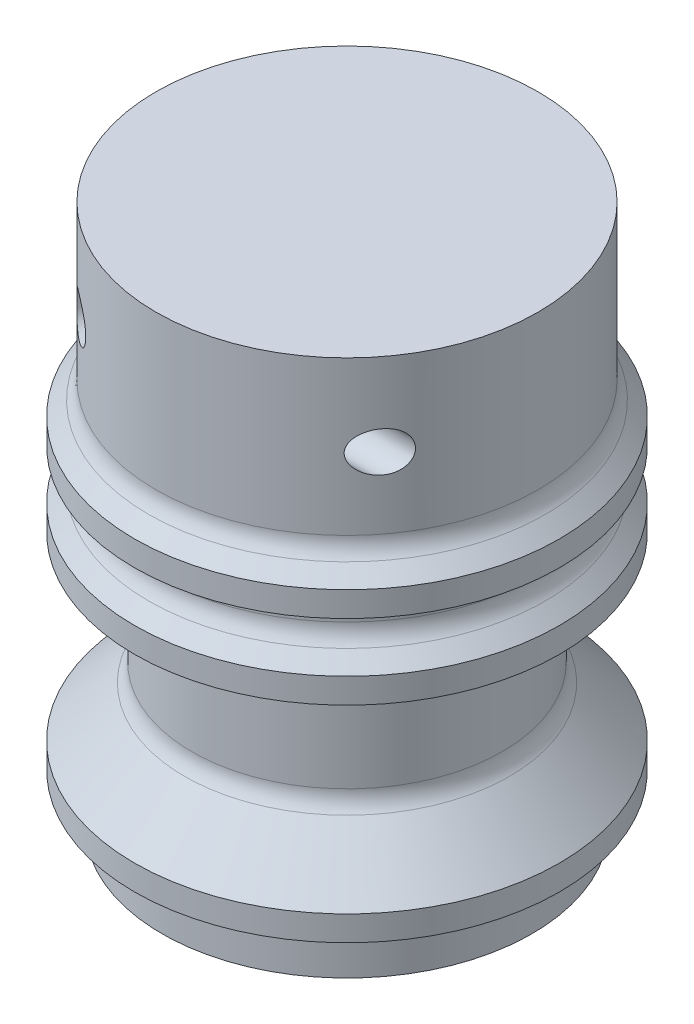
from build123d import *

# Parameters (mm, degrees)
ESBO_O5_R             = 0.802
INLET_1_DEPTH         = 25.204388291
PADR_OCIRCULAR1_COUNT = 4
FILETE_TOPO_R         = 0.35
FILETE_BASE_R         = 2
FILETE4_R             = 1
FILETE5_R             = 0.5


with BuildPart() as part:
    # Esboço4 → Revolução1 (revolve)
    with BuildSketch(Plane.XY, mode=Mode.PRIVATE) as revolu_o1_sk:
        Polygon((3.105, 1), (3.105, 10.329), (5.46, 12.684), (5.46, 19.658), (0, 19.658), (0, 21.658), (7.641447786, 21.658), (7.641447786, 10.732), (6.204569846, 10.732), (6.204569846, 4), (7.4, 4), (7.4, 0), (5.798, 0), (5.798, 2.899), (4.889, 4.473434184), (4.889, 4.889), (4.889, 9.232), (4.105, 9.232), (4.105, 1), align=None)
    revolve(revolu_o1_sk.sketch.rotate(Axis((0, 0, 0), (0, 1, 0)), 90), axis=Axis((0, 0, 0), (0, 1, 0)))

    # Esboço5 → Inlet_1 (cut, through all)
    with BuildSketch(Plane.XY):
        with Locations((4.658, 18.356)):
            Circle(ESBO_O5_R)
    inlet_1 = extrude(amount=-INLET_1_DEPTH, mode=Mode.SUBTRACT)

    # PadrãoCircular1: Inlet_1 ×4 about axis
    padr_ocircular1_axis = Axis((0, 0, 0), (0, -1, 0))
    for i in range(1, PADR_OCIRCULAR1_COUNT):
        add(inlet_1.rotate(padr_ocircular1_axis, i * 360 / PADR_OCIRCULAR1_COUNT), mode=Mode.SUBTRACT)

    # Filete_topo
    filete_topo_edges = [part.edges().sort_by_distance(p)[0] for p in [
        (0, 9.232, 4.105),
        (0, 9.232, 4.889),
        (0, 19.658, 5.46),
    ]]
    fillet(filete_topo_edges, radius=FILETE_TOPO_R)

    # Filete_base
    filete_base_edges = [part.edges().sort_by_distance(p)[0] for p in [
        (0, 4.473434184, 4.889),
        (0, 2.899, 5.798),
        (0, 12.684, 5.46),
        (0, 10.329, 3.105),
    ]]
    fillet(filete_base_edges, radius=FILETE_BASE_R)

    # Esboço11 → Revolução2 (revolve)
    with BuildSketch(Plane.XY, mode=Mode.PRIVATE) as revolu_o2_sk:
        Polygon((6.204569846, 10.232), (8.5, 10.232), (8.5, 11.232), (7.641447786, 12.090552214), (7.641447786, 13.232), (8.5, 13.232), (8.5, 14.232), (7.641447786, 15.090552214), (7.141447786, 15.090552214), (7.141447786, 11.232), (5.704569846, 11.232), (5.704569846, 10.232), align=None)
        Polygon((7.4, 2), (8.5, 2), (8.5, 3), (6.204569846, 5.295430154), (5.704569846, 5.295430154), (5.704569846, 4), (6.9, 2), align=None)
    revolve(revolu_o2_sk.sketch.rotate(Axis((0, 0, 0), (0, 1, 0)), 90), axis=Axis((0, 0, 0), (0, 1, 0)))

    # Filete4
    filete4_edges = [part.edges().sort_by_distance(p)[0] for p in [
        (0, 10.232, 6.204569846),
        (0, 15.090552214, 7.641447786),
        (0, 12.090552214, 7.641447786),
        (0, 5.295430154, 6.204569846),
    ]]
    fillet(filete4_edges, radius=FILETE4_R)

    # Filete5
    filete5_edges = [part.edges().sort_by_distance(p)[0] for p in [
        (0, 13.232, 7.641447786),
        (0, 2, 7.4),
    ]]
    fillet(filete5_edges, radius=FILETE5_R)

    # Esboço12 → Revolução3 (revolve)
    with BuildSketch(Plane.XY, mode=Mode.PRIVATE) as revolu_o3_sk:
        Polygon((-3.645928894, 1), (-6.491366416, 1), (-6.491366416, 3.658416747), (-5.396237997, 5.811323507), (-5.396237997, 9.887742378), (-3.645928894, 9.887742378), align=None)
    revolve(revolu_o3_sk.sketch.rotate(Axis((0, 0, 0), (0, -1, 0)), 90), axis=Axis((0, 0, 0), (0, -1, 0)))


solid = part.part
